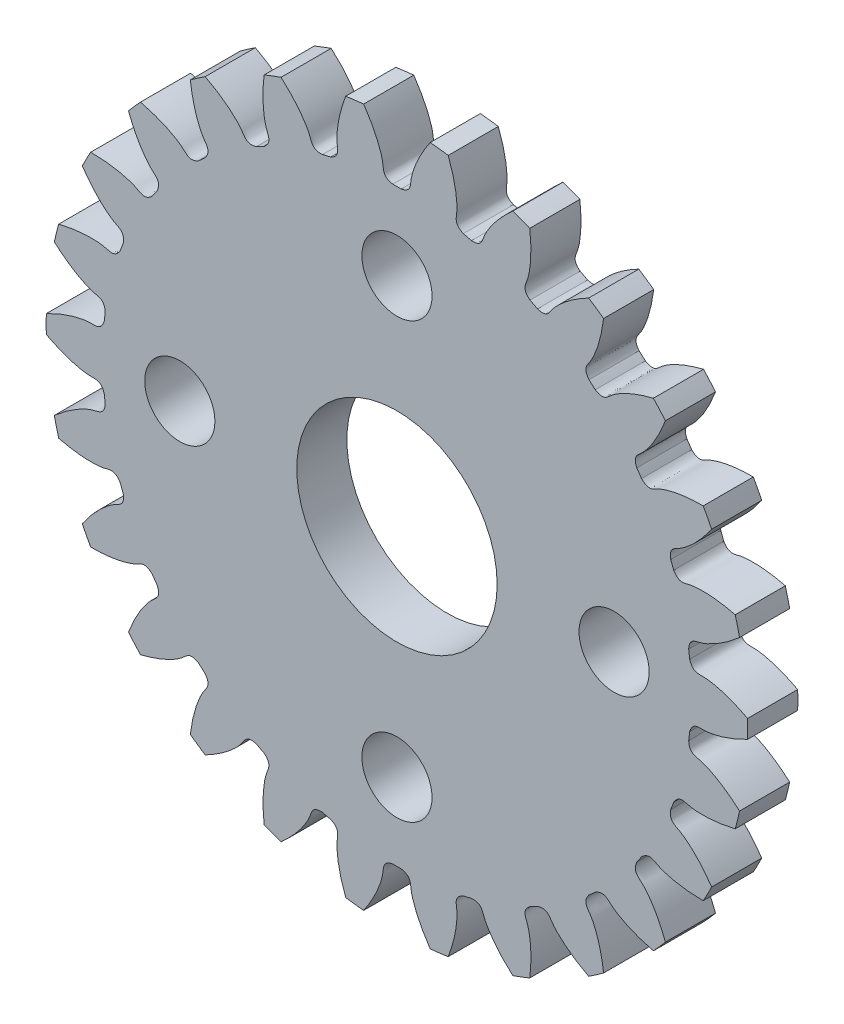
from build123d import *

# Parameters (mm, degrees)
SKETCH_1_R               = 21
EXTRUDE_1_DEPTH          = 3
CUT_EXTRUDE_1_DEPTH      = 30.849623113
PATTERN_CIRCULAR_1_COUNT = 26
SKETCH_5_R               = 2.1
SKETCH_5_R_2             = 6
CUT_EXTRUDE_2_DEPTH      = 30.78305756


with BuildPart() as part:
    # 草图1 → 凸台-拉伸1 (new body)
    with BuildSketch(Plane.XY):
        Circle(SKETCH_1_R)
    extrude(amount=EXTRUDE_1_DEPTH)

    # 草图2 → 切除-拉伸1 (cut, through all)
    with BuildSketch(Plane.XY):
        with BuildLine():
            ThreePointArc((0.250624652, 17.623217989), (0, 17.625), (-0.250624652, 17.623217989))
            add(Edge.make_bspline(
                [(-0.250624652, 17.623217989), (-0.844686866, 17.735679794), (-0.795512245, 18.086920865), (-0.851104987, 18.438276878), (-0.859455348, 18.485184312), (-0.870175036, 18.539103804), (-0.883535859, 18.599959078), (-0.899822615, 18.667662348), (-0.91931266, 18.74211835), (-0.942282228, 18.823223121), (-0.969004131, 18.910864475), (-0.999748181, 19.004921959), (-1.034780771, 19.105266968), (-1.074364718, 19.211762826), (-1.118759031, 19.324264878), (-1.168218697, 19.442620593), (-1.222994475, 19.566669664), (-1.283332682, 19.69624412), (-1.349474992, 19.831168437), (-1.421658229, 19.971259663), (-1.500114168, 20.116327539), (-1.58506934, 20.266174627), (-1.676744838, 20.420596451), (-1.775356121, 20.579381632), (-1.881112837, 20.742312032), (-1.994218628, 20.909162904), (-2.114870962, 21.07970305), (-2.243260946, 21.253694971), (-2.379573161, 21.430895037), (-2.523985491, 21.61105365), (-2.67666896, 21.793915416), (-2.837787571, 21.979219323), (-3.007498151, 22.166698916), (-3.1859502, 22.356082485), (-3.373285743, 22.54709325), (-3.569639189, 22.739449553), (-3.775137192, 22.93286505), (-3.989898532, 23.127048914), (-4.21403392, 23.321706036), (-4.529269688, 23.584610761), (-4.774493507, 23.77681499), (-4.942363734, 23.903177796)],
                knots=[0, 0, 0, 0, 0.122665365, 0.127715434, 0.133683697, 0.140570154, 0.148374806, 0.157097651, 0.166738691, 0.177297926, 0.188775354, 0.201170977, 0.214484794, 0.228716806, 0.243867011, 0.259935411, 0.276922005, 0.294826794, 0.313649777, 0.333390954, 0.354050325, 0.37562789, 0.39812365, 0.421537604, 0.445869753, 0.471120096, 0.497288632, 0.524375364, 0.552380289, 0.581303409, 0.611144723, 0.641904231, 0.673581934, 0.706177831, 0.739691922, 0.774124208, 0.809474687, 0.845743361, 0.88293023, 0.921035292, 1, 1, 1, 1], degree=3))
            ThreePointArc((-4.942363734, 23.903177796), (0, 24.408786697), (4.942363734, 23.903177796))
            add(Edge.make_bspline(
                [(0.250624652, 17.623217989), (0.844686866, 17.735679794), (0.795512245, 18.086920865), (0.851104987, 18.438276878), (0.859455348, 18.485184312), (0.870175036, 18.539103804), (0.883535859, 18.599959078), (0.899822615, 18.667662348), (0.91931266, 18.74211835), (0.942282228, 18.823223121), (0.969004131, 18.910864475), (0.999748181, 19.004921959), (1.034780771, 19.105266968), (1.074364718, 19.211762826), (1.118759031, 19.324264878), (1.168218697, 19.442620593), (1.222994475, 19.566669664), (1.283332682, 19.69624412), (1.349474992, 19.831168437), (1.421658229, 19.971259663), (1.500114168, 20.116327539), (1.58506934, 20.266174627), (1.676744838, 20.420596451), (1.775356121, 20.579381632), (1.881112837, 20.742312032), (1.994218628, 20.909162904), (2.114870962, 21.07970305), (2.243260946, 21.253694971), (2.379573161, 21.430895037), (2.523985491, 21.61105365), (2.67666896, 21.793915416), (2.837787571, 21.979219323), (3.007498151, 22.166698916), (3.1859502, 22.356082485), (3.373285743, 22.54709325), (3.569639189, 22.739449553), (3.775137192, 22.93286505), (3.989898532, 23.127048914), (4.21403392, 23.321706036), (4.529269688, 23.584610761), (4.774493507, 23.77681499), (4.942363734, 23.903177796)],
                knots=[0, 0, 0, 0, 0.122665365, 0.127715434, 0.133683697, 0.140570154, 0.148374806, 0.157097651, 0.166738691, 0.177297926, 0.188775354, 0.201170977, 0.214484794, 0.228716806, 0.243867011, 0.259935411, 0.276922005, 0.294826794, 0.313649777, 0.333390954, 0.354050325, 0.37562789, 0.39812365, 0.421537604, 0.445869753, 0.471120096, 0.497288632, 0.524375364, 0.552380289, 0.581303409, 0.611144723, 0.641904231, 0.673581934, 0.706177831, 0.739691922, 0.774124208, 0.809474687, 0.845743361, 0.88293023, 0.921035292, 1, 1, 1, 1], degree=3))
        make_face()
    cut_extrude_1 = extrude(amount=CUT_EXTRUDE_1_DEPTH, mode=Mode.SUBTRACT)

    # 阵列(圆周)1: 切除-拉伸1 ×26 about axis
    pattern_circular_1_axis = Axis((0, 0, -0.15), (0, 0, 1))
    for i in range(1, PATTERN_CIRCULAR_1_COUNT):
        add(cut_extrude_1.rotate(pattern_circular_1_axis, i * 360 / PATTERN_CIRCULAR_1_COUNT), mode=Mode.SUBTRACT)

    # 草图5 → 切除-拉伸2 (cut, through all)
    with BuildSketch(Plane.XY.offset(3)):
        with Locations((0, 13)):
            Circle(SKETCH_5_R)
        with Locations((13, 0)):
            Circle(SKETCH_5_R)
        with Locations((0, -13)):
            Circle(SKETCH_5_R)
        with Locations((-13, 0)):
            Circle(SKETCH_5_R)
        Circle(SKETCH_5_R_2)
    extrude(amount=-CUT_EXTRUDE_2_DEPTH, mode=Mode.SUBTRACT)


solid = part.part
